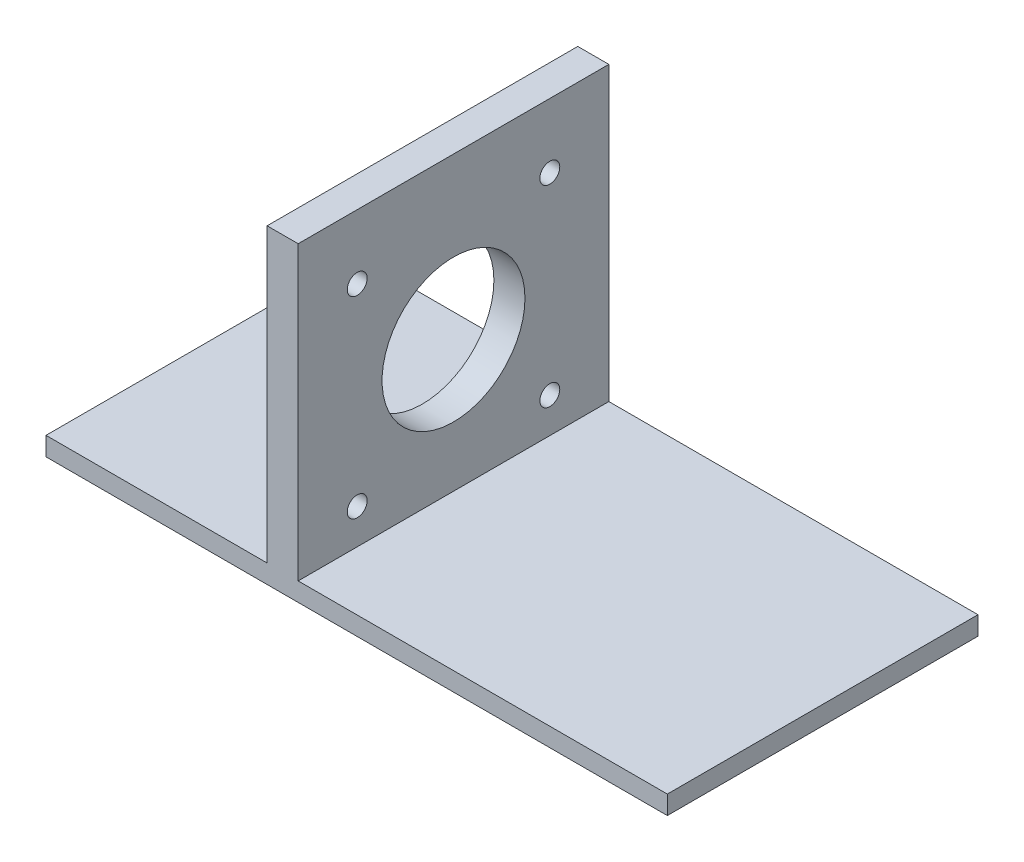
from build123d import *

# Parameters (mm, degrees)
SKETCH1_W           = 100
SKETCH1_H           = 50
BOSS_EXTRUDE1_DEPTH = 3
SKETCH2_W           = 5
SKETCH2_H           = 50
BOSS_EXTRUDE3_DEPTH = 47
SKETCH8_R           = 11.5
CUT_EXTRUDE3_DEPTH  = 82.577573944
SKETCH9_R           = 1.6
CUT_EXTRUDE4_DEPTH  = 82.577573944


with BuildPart() as part:
    # Sketch1 → Boss-Extrude1 (new body)
    with BuildSketch(Plane(origin=(0, 0, 0), x_dir=(1, 0, 0), z_dir=(0, 1, 0))):
        Rectangle(SKETCH1_W, SKETCH1_H)
    extrude(amount=BOSS_EXTRUDE1_DEPTH)

    # Sketch2 → Boss-Extrude3 (add)
    with BuildSketch(Plane(origin=(0, 3, 0), x_dir=(1, 0, 0), z_dir=(0, 1, 0))):
        with Locations((-11.912966351, 0)):
            Rectangle(SKETCH2_W, SKETCH2_H)
    extrude(amount=BOSS_EXTRUDE3_DEPTH)

    # Sketch8 → Cut-Extrude3 (cut, through all)
    with BuildSketch(Plane(origin=(-9.412966351, 0, 0), x_dir=(0, 0, -1), z_dir=(1, 0, 0))):
        with Locations((1.43e-06, 24.15)):
            Circle(SKETCH8_R)
    extrude(amount=-CUT_EXTRUDE3_DEPTH, mode=Mode.SUBTRACT)

    # Sketch9 → Cut-Extrude4 (cut, through all)
    with BuildSketch(Plane(origin=(-9.412966351, 0, 0), x_dir=(0, 0, -1), z_dir=(1, 0, 0))):
        with Locations((-15.49999857, 8.65)):
            Circle(SKETCH9_R)
        with Locations((-15.49999857, 39.65)):
            Circle(SKETCH9_R)
        with Locations((15.49999857, 39.65)):
            Circle(SKETCH9_R)
        with Locations((15.49999857, 8.65)):
            Circle(SKETCH9_R)
    extrude(amount=-CUT_EXTRUDE4_DEPTH, mode=Mode.SUBTRACT)


solid = part.part
